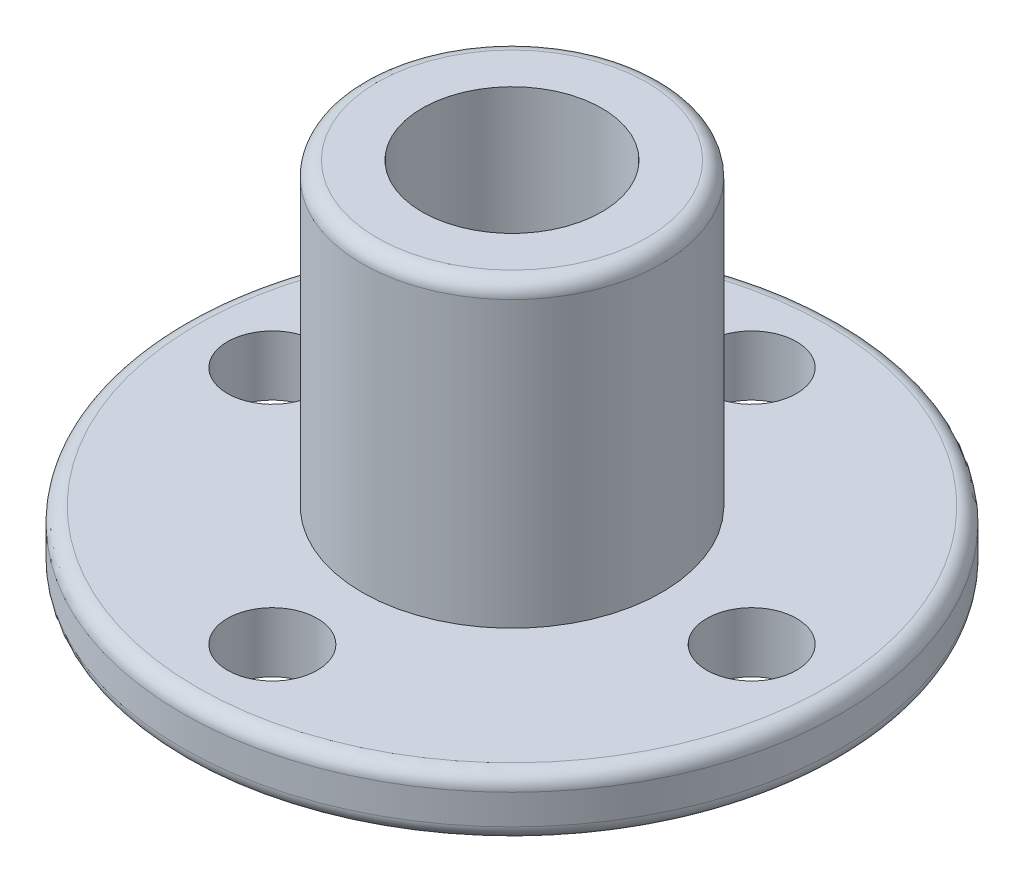
from build123d import *

# Parameters (mm, degrees)
SKETCH_1_R               = 11
EXTRUDE_1_DEPTH          = 2
SKETCH_2_R               = 1.5
CUT_EXTRUDE_1_DEPTH      = 2
SKETCH_3_R               = 5
EXTRUDE_2_DEPTH          = 10
SKETCH_4_R               = 3
CUT_EXTRUDE_2_DEPTH      = 12
FILLET_1_R               = 0.5
CUT_EXTRUDE_3_REACH      = 21.647
CUT_EXTRUDE_3_END_RADIUS = 5
SKETCH_5_R               = 1.5


with BuildPart() as part:
    # 草图1 → 凸台-拉伸1 (new body)
    with BuildSketch(Plane(origin=(0, 0, 0), x_dir=(1, 0, 0), z_dir=(0, 1, 0))):
        with Locations(Location((0, 0, 0), (0, 0, 270))):
            Circle(SKETCH_1_R)
    extrude(amount=EXTRUDE_1_DEPTH)

    # 草图2 → 切除-拉伸1 (cut)
    with BuildSketch(Plane(origin=(0, 2, 0), x_dir=(1, 0, 0), z_dir=(0, 1, 0))):
        with Locations(Location((0, 8, 0), (0, 0, 270))):
            Circle(SKETCH_2_R)
        with Locations(Location((8, 0, 0), (0, 0, 270))):
            Circle(SKETCH_2_R)
        with Locations(Location((0, -8, 0), (0, 0, 270))):
            Circle(SKETCH_2_R)
        with Locations(Location((-8, 0, 0), (0, 0, 270))):
            Circle(SKETCH_2_R)
    extrude(amount=-CUT_EXTRUDE_1_DEPTH, mode=Mode.SUBTRACT)

    # 草图3 → 凸台-拉伸2 (add)
    with BuildSketch(Plane(origin=(0, 2, 0), x_dir=(1, 0, 0), z_dir=(0, 1, 0))):
        with Locations(Location((0, 0, 0), (0, 0, 270))):
            Circle(SKETCH_3_R)
    extrude(amount=EXTRUDE_2_DEPTH)

    # 草图4 → 切除-拉伸2 (cut)
    with BuildSketch(Plane(origin=(0, 12, 0), x_dir=(1, 0, 0), z_dir=(0, 1, 0))):
        with Locations(Location((0, 0, 0), (0, 0, 270))):
            Circle(SKETCH_4_R)
    extrude(amount=-CUT_EXTRUDE_2_DEPTH, mode=Mode.SUBTRACT)

    # 圆角1
    fillet_1_edges = [part.edges().sort_by_distance(p)[0] for p in [
        (0, 0, -11),
        (0, 12, -5),
        (0, 2, -11),
    ]]
    fillet(fillet_1_edges, radius=FILLET_1_R)

    # 切除-拉伸3: up to this cylinder (the profile starts inside it)
    cut_extrude_3_end = Plane(origin=(0, 7, 0), z_dir=(0, -1, 0)) * Cylinder(CUT_EXTRUDE_3_END_RADIUS, 54.294, mode=Mode.PRIVATE)
    # 草图5 → 切除-拉伸3 (cut, up to the surface)
    with BuildSketch(Plane.XY, mode=Mode.PRIVATE) as cut_extrude_3_sk1:
        with Locations((0, 7)):
            Circle(SKETCH_5_R)
    cut_extrude_3_tool1 = extrude(cut_extrude_3_sk1.sketch, amount=-CUT_EXTRUDE_3_REACH, mode=Mode.PRIVATE) & cut_extrude_3_end
    add(cut_extrude_3_tool1.solids().sort_by_distance((0, 7, 0))[0], mode=Mode.SUBTRACT)


solid = part.part
